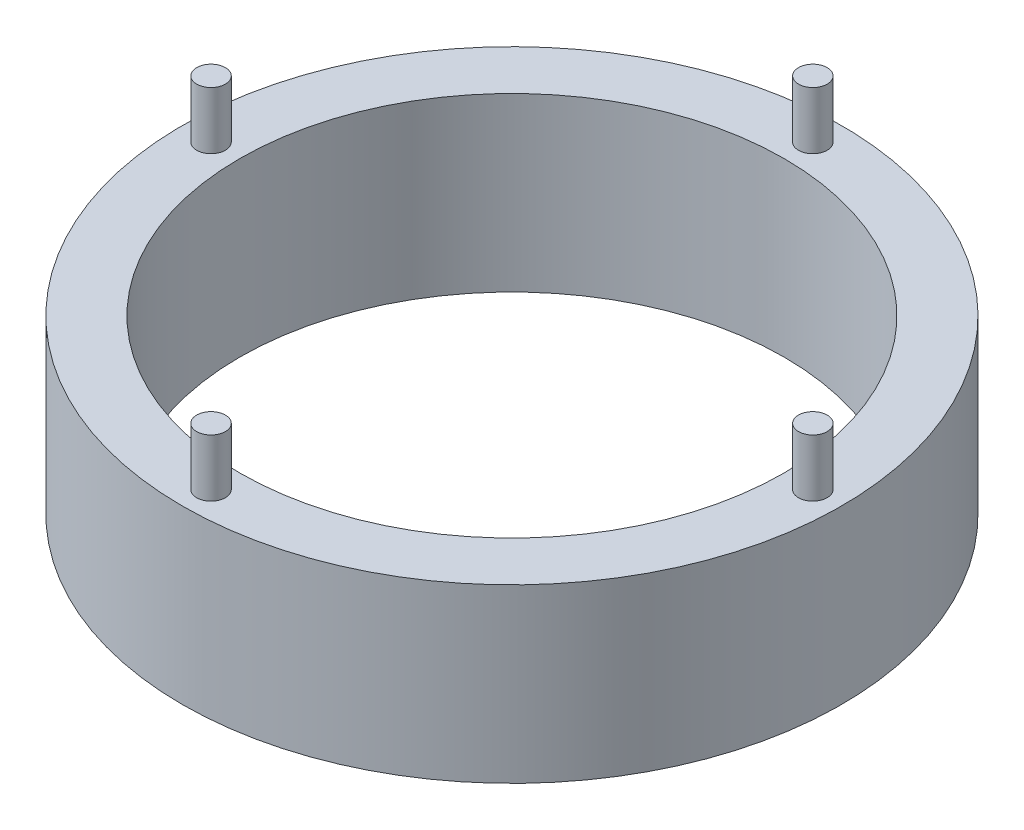
from build123d import *

# Parameters (mm, degrees)
ESQUISSE1_R             = 57.5
ESQUISSE1_R_2           = 47.5
BOSS_EXTRU_1_DEPTH      = 30
ESQUISSE3_R             = 2.5
BOSS_EXTRU_3_DEPTH      = 40
ESQUISSE23_R            = 2.5
ENL_V_MAT_EXTRU_1_DEPTH = 10
ESQUISSE22_R            = 2.5
ENL_V_MAT_EXTRU_2_DEPTH = 10
ESQUISSE20_R            = 2.5
ENL_V_MAT_EXTRU_3_DEPTH = 10


with BuildPart() as part:
    # Esquisse1 → Boss.-Extru.1 (new body)
    with BuildSketch(Plane(origin=(0, 0, 0), x_dir=(1, 0, 0), z_dir=(0, 1, 0))):
        with Locations(Location((0, 0, 0), (0, 0, 270))):
            Circle(ESQUISSE1_R)
        with Locations(Location((0, 0, 0), (0, 0, 270))):
            Circle(ESQUISSE1_R_2, mode=Mode.SUBTRACT)
    extrude(amount=BOSS_EXTRU_1_DEPTH)

    # Esquisse3 → Boss.-Extru.3 (add)
    with BuildSketch(Plane(origin=(0, 0, 0), x_dir=(1, 0, 0), z_dir=(0, 1, 0))):
        with Locations(Location((0, 52.5, 0), (0, 0, 270))):
            Circle(ESQUISSE3_R)
        with Locations(Location((0, -52.5, 0), (0, 0, 270))):
            Circle(ESQUISSE3_R)
        with Locations(Location((-52.5, 0, 0), (0, 0, 270))):
            Circle(ESQUISSE3_R)
        with Locations(Location((52.5, 0, 0), (0, 0, 270))):
            Circle(ESQUISSE3_R)
    extrude(amount=BOSS_EXTRU_3_DEPTH)

    # Esquisse23 → Enlèv. mat.-Extru.1 (cut)
    with BuildSketch(Plane(origin=(0, 0, 0), x_dir=(1, 0, 0), z_dir=(0, 1, 0))):
        with Locations(Location((52.5, 0, 0), (0, 0, 270))):
            Circle(ESQUISSE23_R)
    extrude(amount=ENL_V_MAT_EXTRU_1_DEPTH, mode=Mode.SUBTRACT)

    # Esquisse22 → Enlèv. mat.-Extru.2 (cut)
    with BuildSketch(Plane(origin=(0, 0, 0), x_dir=(1, 0, 0), z_dir=(0, 1, 0))):
        with Locations(Location((0, 52.5, 0), (0, 0, 270))):
            Circle(ESQUISSE22_R)
    extrude(amount=ENL_V_MAT_EXTRU_2_DEPTH, mode=Mode.SUBTRACT)

    # Esquisse20 → Enlèv. mat.-Extru.3 (cut)
    with BuildSketch(Plane(origin=(0, 0, 0), x_dir=(1, 0, 0), z_dir=(0, 1, 0))):
        with Locations(Location((0, -52.5, 0), (0, 0, 270))):
            Circle(ESQUISSE20_R)
        with Locations(Location((-52.5, 0, 0), (0, 0, 270))):
            Circle(ESQUISSE20_R)
        with Locations(Location((0, 52.5, 0), (0, 0, 270))):
            Circle(ESQUISSE20_R)
        with Locations(Location((52.5, 0, 0), (0, 0, 270))):
            Circle(ESQUISSE20_R)
    extrude(amount=ENL_V_MAT_EXTRU_3_DEPTH, mode=Mode.SUBTRACT)


solid = part.part
